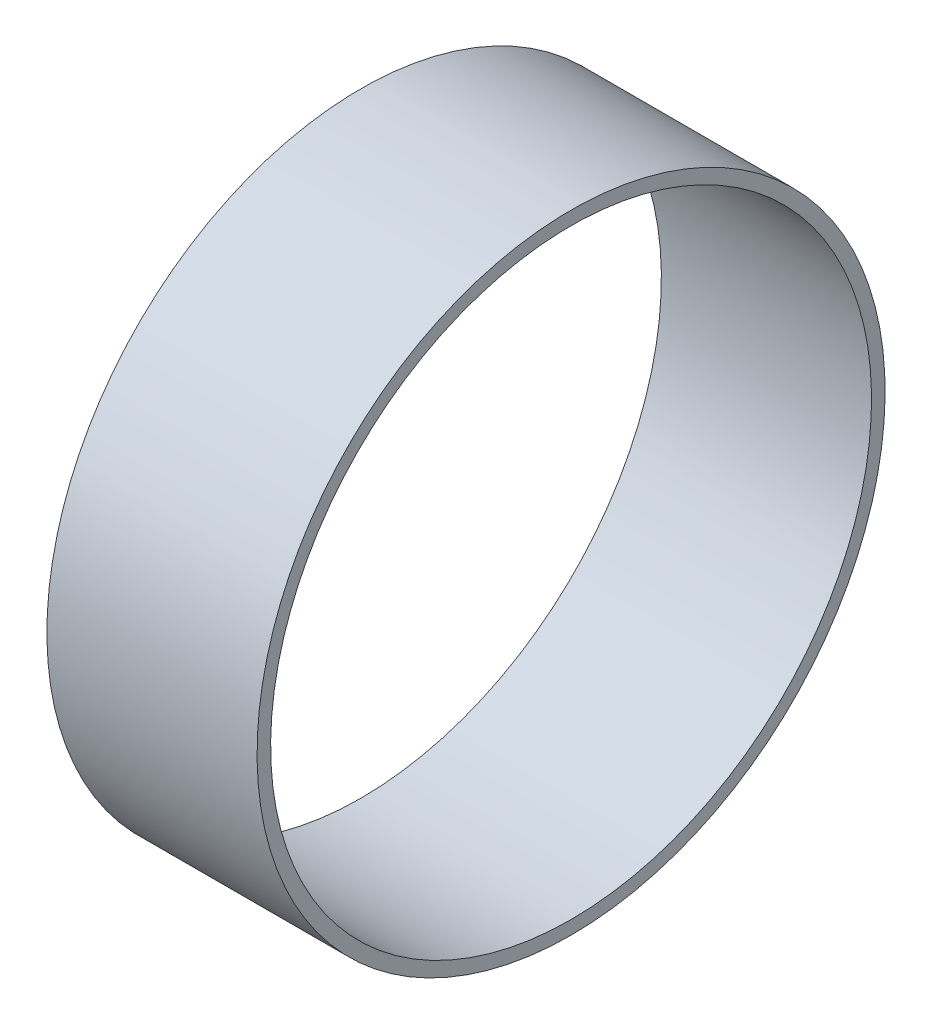
from build123d import *

# Parameters (mm, degrees)
ESQUISSE1_W = 15.5
ESQUISSE1_H = 1


with BuildPart() as part:
    # Esquisse1 → Base-Révol.-Mince (revolve)
    with BuildSketch(Plane.XY, mode=Mode.PRIVATE) as base_r_vol_mince_sk:
        with Locations((37.5, 22.66)):
            Rectangle(ESQUISSE1_W, ESQUISSE1_H)
    revolve(base_r_vol_mince_sk.sketch.rotate(Axis((0, 0, 0), (1, 0, 0)), 180), axis=Axis((0, 0, 0), (1, 0, 0)))


solid = part.part
